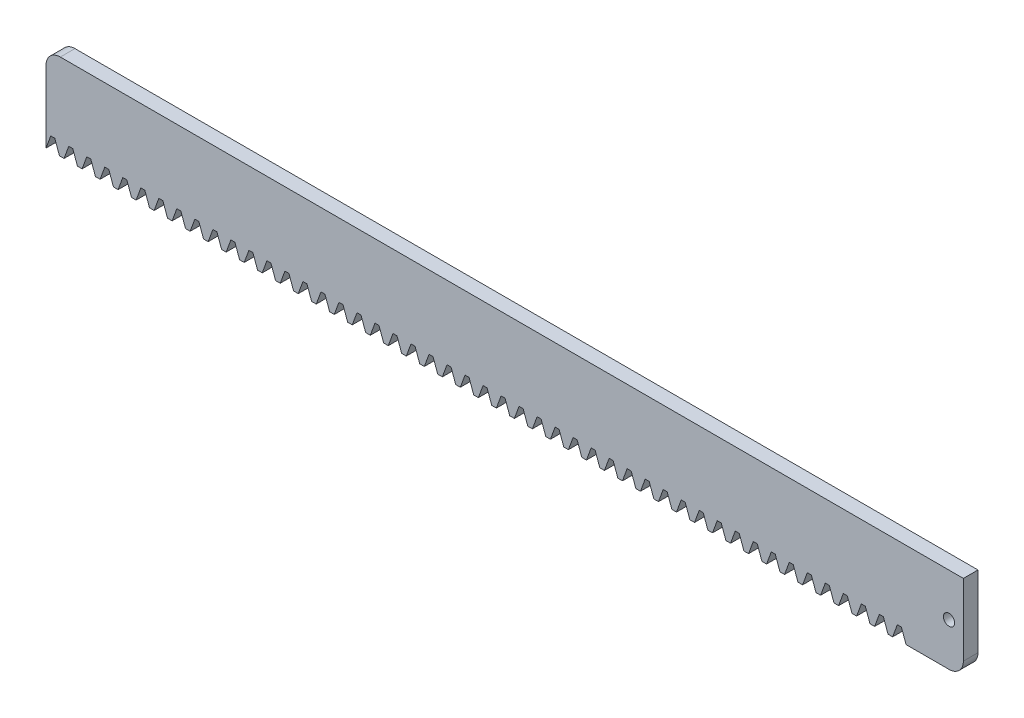
from build123d import *

# Parameters (mm, degrees)
SKETCH1_R           = 2.4892
BOSS_EXTRUDE1_DEPTH = 6.477
FILLET2_R           = 6.35
CUT_EXTRUDE1_DEPTH  = 409.233415498
LPATTERN1_COUNT     = 61
LPATTERN1_PITCH     = 7.979645331


with BuildPart() as part:
    # Sketch1 → Boss-Extrude1 (new body)
    with BuildSketch(Plane.XY):
        Polygon((0, 0), (0, 38.1), (40.53078, 38.1), (406.4, 38.1), (406.4, 0), align=None)
        with Locations((400.05, 19.05)):
            Circle(SKETCH1_R, mode=Mode.SUBTRACT)
    extrude(amount=BOSS_EXTRUDE1_DEPTH)

    # Fillet2
    fillet2_edges = [part.edges().sort_by_distance(p)[0] for p in [
        (0, 38.1, 3.2385),
        (406.4, 0, 3.2385),
    ]]
    fillet(fillet2_edges, radius=FILLET2_R)

    # Sketch2 → Cut-Extrude1 (cut, through all)
    with BuildSketch(Plane.XY.offset(6.477)):
        Polygon((375.06876001, 0), (381, 0), (378.919910111, 5.715), (377.148849899, 5.715), align=None)
    cut_extrude1 = extrude(amount=-CUT_EXTRUDE1_DEPTH, mode=Mode.SUBTRACT)

    # LPattern1: Cut-Extrude1 ×61
    with Locations(*[(-i * LPATTERN1_PITCH, 0, 0) for i in range(1, LPATTERN1_COUNT)]):
        add(cut_extrude1, mode=Mode.SUBTRACT)


solid = part.part
